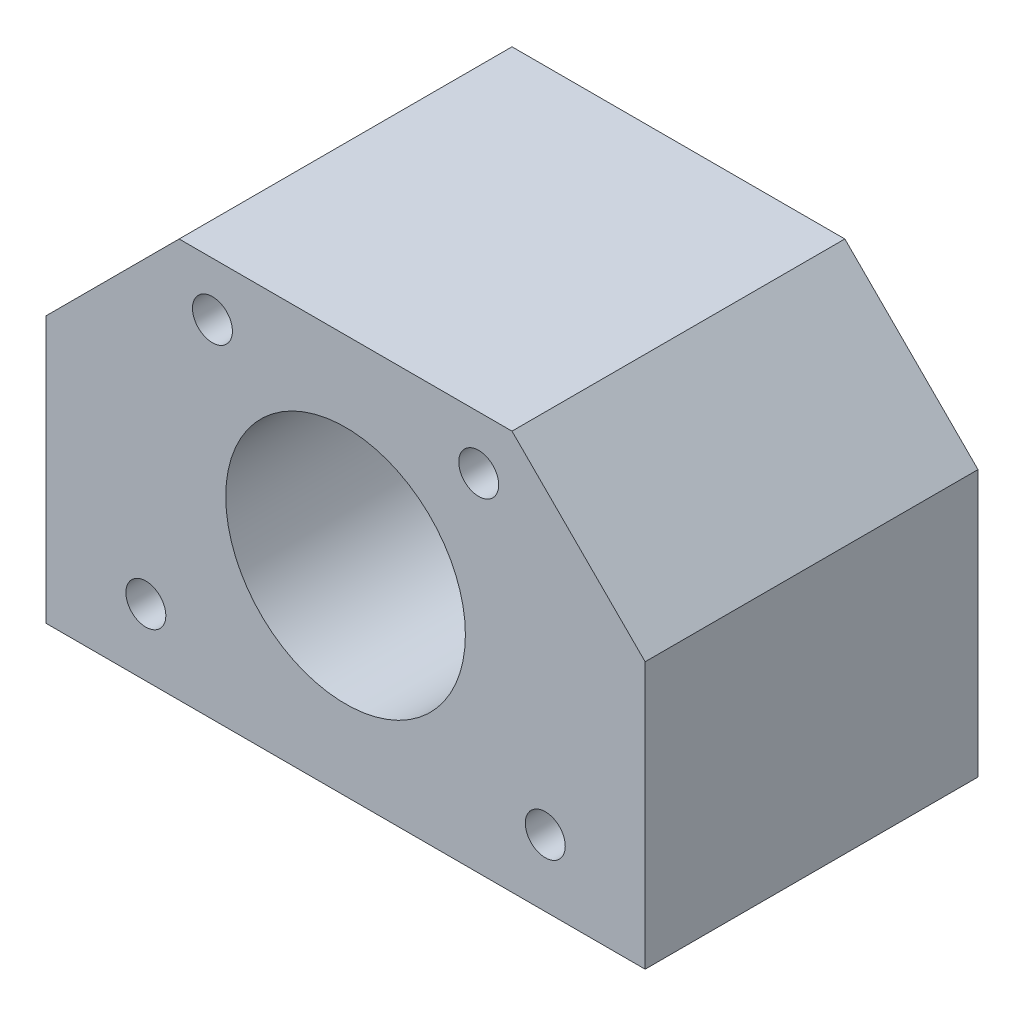
from build123d import *

# Parameters (mm, degrees)
CROQUIS1_R              = 9
SALIENTE_EXTRUIR1_DEPTH = 25
CROQUIS2_R              = 1.5
CORTAR_EXTRUIR1_DEPTH   = 25


with BuildPart() as part:
    # Croquis1 → Saliente-Extruir1 (new body)
    with BuildSketch(Plane.XY):
        Polygon((-22.5, 5), (-12.5, 15), (12.5, 15), (22.5, 5), (22.5, -15), (-22.5, -15), align=None)
        Circle(CROQUIS1_R, mode=Mode.SUBTRACT)
    extrude(amount=SALIENTE_EXTRUIR1_DEPTH)

    # Croquis2 → Cortar-Extruir1 (cut)
    with BuildSketch(Plane.XY.offset(25)):
        with Locations((-15, -10)):
            Circle(CROQUIS2_R)
        with Locations((15, -10)):
            Circle(CROQUIS2_R)
        with Locations((-10, 11)):
            Circle(CROQUIS2_R)
        with Locations((10, 11)):
            Circle(CROQUIS2_R)
    extrude(amount=-CORTAR_EXTRUIR1_DEPTH, mode=Mode.SUBTRACT)


solid = part.part
